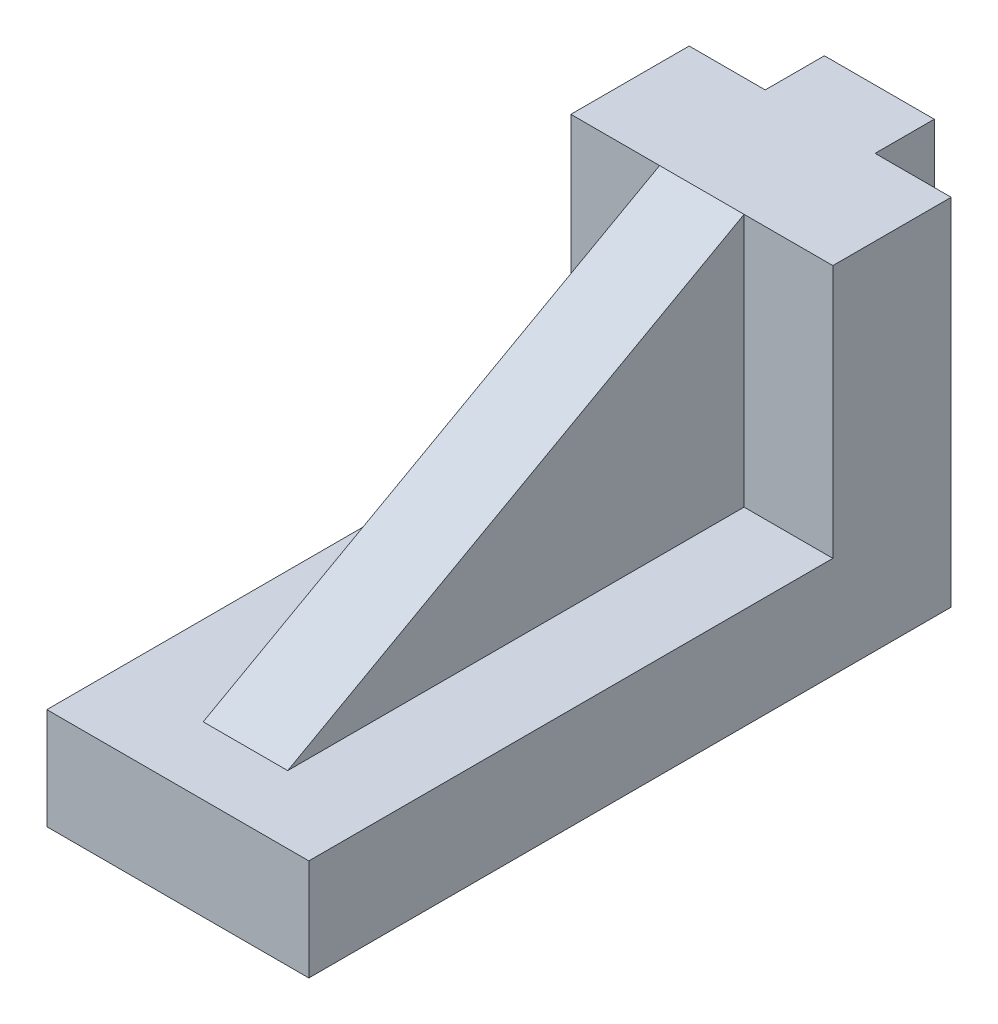
from build123d import *

# Parameters (mm, degrees)
SALIENTE_EXTRUIR1_DEPTH = 15.5
CROQUIS2_W              = 13
CROQUIS2_H              = 7
SALIENTE_EXTRUIR2_DEPTH = 42
NERVIO1_REACH           = 90.206
CROQUIS3_WALL_W         = 240.185231722
CROQUIS3_WALL_H         = 10


with BuildPart() as part:
    # Croquis1 → Saliente-Extruir1 (new, symmetric)
    with BuildSketch(Plane(origin=(0, 0, 0), x_dir=(0, 0, -1), z_dir=(1, 0, 0))):
        Polygon((-14, 42), (0, 42), (0, 0), (-76, 0), (-76, 12), (-14, 12), align=None)
    extrude(amount=SALIENTE_EXTRUIR1_DEPTH, both=True)

    # Croquis2 → Saliente-Extruir2 (add)
    with BuildSketch(Plane(origin=(0, 42, 0), x_dir=(1, 0, 0), z_dir=(0, 1, 0))):
        with Locations((0, 3.5)):
            Rectangle(CROQUIS2_W, CROQUIS2_H)
    extrude(amount=-SALIENTE_EXTRUIR2_DEPTH)

    # Croquis3 wall → Nervio1 (add, up to next)
    with BuildSketch(Plane(origin=(0, 27, 41), x_dir=(0, -0.485642931179, 0.874157276122), z_dir=(0, -0.874157276122, -0.485642931179)), mode=Mode.PRIVATE) as nervio1_sk1:
        Rectangle(CROQUIS3_WALL_W, CROQUIS3_WALL_H)
    nervio1_tool1 = extrude(nervio1_sk1.sketch, amount=NERVIO1_REACH, mode=Mode.PRIVATE) - part.part
    add(nervio1_tool1.solids().sort_by_distance((0, 27, 41))[0])


solid = part.part
